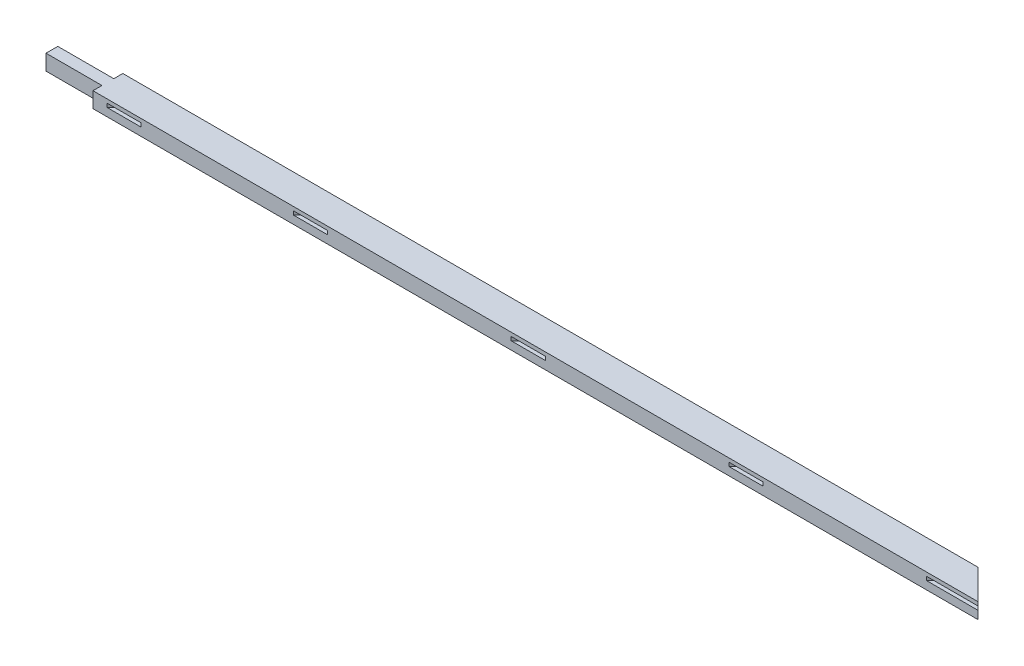
from build123d import *

# Parameters (mm, degrees)
EXTRUDE_1_DEPTH               = 25
CUT_EXTRUDE_START             = -6
CUT_EXTRUDE_1_DEPTH           = 6
PATTERN_LINEAR_1_COUNT        = 2
PATTERN_LINEAR_1_PITCH        = 300
PATTERN_START                 = -6
PATTERN_LINEAR_3_COPY_1_DEPTH = 6
PATTERN_LINEAR_3_COPY_2_DEPTH = 6
MIRROR_START                  = -6
MIRROR_5_COPY_1_DEPTH         = 6
MIRROR_5_COPY_2_DEPTH         = 6
MIRROR_5_COPY_3_DEPTH         = 6
MIRROR_5_COPY_4_DEPTH         = 6
MIRROR_5_COPY_5_DEPTH         = 6
CUT_EXTRUDE_3_DEPTH           = 6
CUT_EXTRUDE_4_DEPTH           = 6


with BuildPart() as part:
    # 草图1 → 凸台-拉伸1 (new body)
    with BuildSketch(Plane(origin=(0, 0, 0), x_dir=(1, 0, 0), z_dir=(0, 1, 0))):
        Polygon((0, 0), (0, -9.5), (90, -9.5), (90, -24), (1513, -24), (1465, 24), (90, 24), (90, 9.5), (0, 9.5), align=None)
    extrude(amount=EXTRUDE_1_DEPTH)

    # 草图2 → 切除-拉伸1 (cut)
    with BuildSketch(Plane(origin=(0, 25, 0), x_dir=(1, 0, 0), z_dir=(0, 1, 0)).offset(CUT_EXTRUDE_START)):
        Polygon((112.5, 24), (120, 16.5), (160, 16.5), (167.5, 24), align=None)
    cut_extrude_1 = extrude(amount=-CUT_EXTRUDE_1_DEPTH, mode=Mode.SUBTRACT)

    # 阵列(线性)1: 切除-拉伸1 ×2
    with Locations(*[(i * PATTERN_LINEAR_1_PITCH, 0, 0) for i in range(1, PATTERN_LINEAR_1_COUNT)]):
        add(cut_extrude_1, mode=Mode.SUBTRACT)

    # 阵列(线性)3 copy 1 sketch → 阵列(线性)3 copy 1 (cut)
    with BuildSketch(Plane(origin=(650, 25, 0), x_dir=(1, 0, 0), z_dir=(0, 1, 0)).offset(PATTERN_START)):
        Polygon((112.5, 24), (120, 16.5), (160, 16.5), (167.5, 24), align=None)
    extrude(amount=-PATTERN_LINEAR_3_COPY_1_DEPTH, mode=Mode.SUBTRACT)

    # 阵列(线性)3 copy 2 sketch → 阵列(线性)3 copy 2 (cut)
    with BuildSketch(Plane(origin=(1000, 25, 0), x_dir=(1, 0, 0), z_dir=(0, 1, 0)).offset(PATTERN_START)):
        Polygon((112.5, 24), (120, 16.5), (160, 16.5), (167.5, 24), align=None)
    extrude(amount=-PATTERN_LINEAR_3_COPY_2_DEPTH, mode=Mode.SUBTRACT)

    # 镜向3: 切除-拉伸1 across plane
    add(cut_extrude_1.mirror(Plane.XY), mode=Mode.SUBTRACT)

    # 镜向5 copy 1 sketch → 镜向5 copy 1 (cut)
    with BuildSketch(Plane(origin=(300, 25, 0), x_dir=(1, 0, 0), z_dir=(0, 1, 0)).offset(MIRROR_START)):
        Polygon((112.5, -24), (120, -16.5), (160, -16.5), (167.5, -24), align=None)
    extrude(amount=-MIRROR_5_COPY_1_DEPTH, mode=Mode.SUBTRACT)

    # 镜向5 copy 2 sketch → 镜向5 copy 2 (cut)
    with BuildSketch(Plane(origin=(0, 25, 0), x_dir=(1, 0, 0), z_dir=(0, 1, 0)).offset(MIRROR_START)):
        Polygon((112.5, -24), (120, -16.5), (160, -16.5), (167.5, -24), align=None)
    extrude(amount=-MIRROR_5_COPY_2_DEPTH, mode=Mode.SUBTRACT)

    # 镜向5 copy 3 sketch → 镜向5 copy 3 (cut)
    with BuildSketch(Plane(origin=(650, 25, 0), x_dir=(1, 0, 0), z_dir=(0, 1, 0)).offset(MIRROR_START)):
        Polygon((112.5, -24), (120, -16.5), (160, -16.5), (167.5, -24), align=None)
    extrude(amount=-MIRROR_5_COPY_3_DEPTH, mode=Mode.SUBTRACT)

    # 镜向5 copy 4 sketch → 镜向5 copy 4 (cut)
    with BuildSketch(Plane(origin=(1000, 25, 0), x_dir=(1, 0, 0), z_dir=(0, 1, 0)).offset(MIRROR_START)):
        Polygon((112.5, -24), (120, -16.5), (160, -16.5), (167.5, -24), align=None)
    extrude(amount=-MIRROR_5_COPY_4_DEPTH, mode=Mode.SUBTRACT)

    # 镜向5 copy 5 sketch → 镜向5 copy 5 (cut)
    with BuildSketch(Plane(origin=(0, 25, 0), x_dir=(1, 0, 0), z_dir=(0, 1, 0)).offset(MIRROR_START)):
        Polygon((112.5, -24), (120, -16.5), (160, -16.5), (167.5, -24), align=None)
    extrude(amount=-MIRROR_5_COPY_5_DEPTH, mode=Mode.SUBTRACT)

    # 草图3 → 切除-拉伸3 (cut)
    with BuildSketch(Plane(origin=(0, 25, 0), x_dir=(1, 0, 0), z_dir=(0, 1, 0)).offset(CUT_EXTRUDE_START)):
        Polygon((1430.5, 24), (1438, 16.5), (1472.5, 16.5), (1465, 24), align=None)
    extrude(amount=-CUT_EXTRUDE_3_DEPTH, mode=Mode.SUBTRACT)

    # 草图4 → 切除-拉伸4 (cut)
    with BuildSketch(Plane(origin=(0, 25, 0), x_dir=(1, 0, 0), z_dir=(0, 1, 0)).offset(CUT_EXTRUDE_START)):
        Polygon((1430.5, -24), (1438, -16.5), (1505.5, -16.5), (1513, -24), align=None)
    extrude(amount=-CUT_EXTRUDE_4_DEPTH, mode=Mode.SUBTRACT)


solid = part.part
